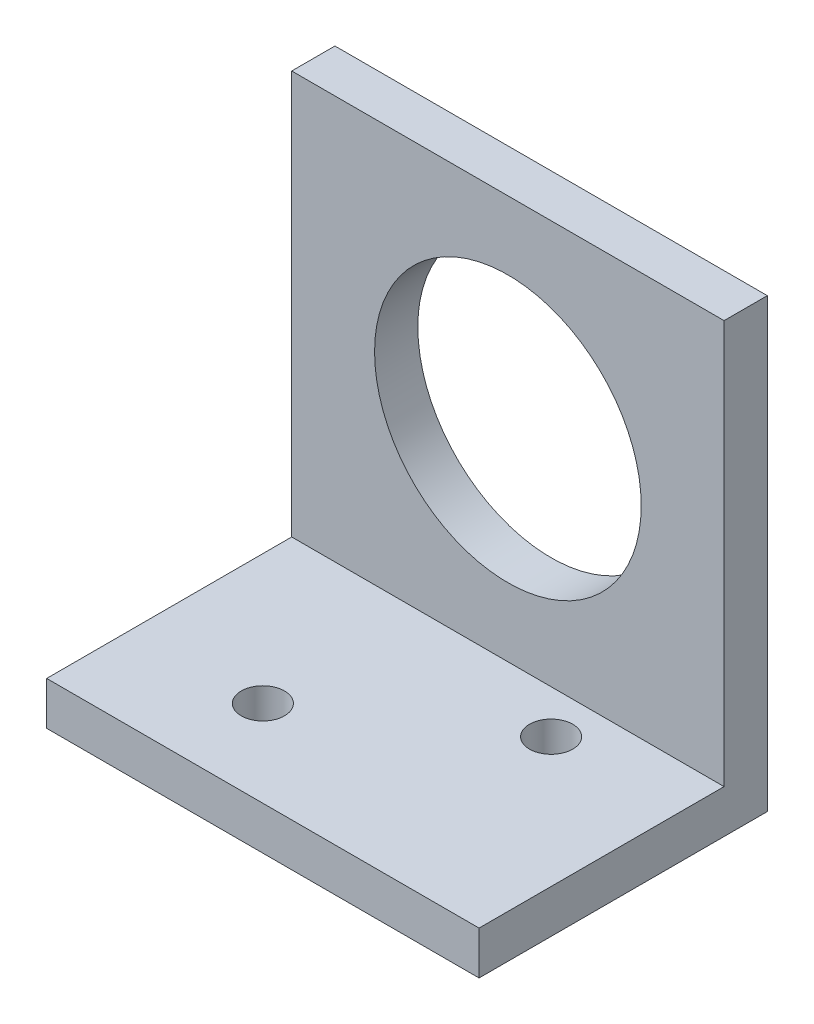
from build123d import *

# Parameters (mm, degrees)
SKETCH1_W           = 30
SKETCH1_H           = 20
SKETCH1_R           = 1.5
BOSS_EXTRUDE1_DEPTH = 3
SKETCH2_W           = 30
SKETCH2_H           = 3
BOSS_EXTRUDE2_DEPTH = 28
SKETCH3_R           = 9.25
CUT_EXTRUDE1_DEPTH  = 17


with BuildPart() as part:
    # Sketch1 → Boss-Extrude1 (new body)
    with BuildSketch(Plane(origin=(0, 0, 0), x_dir=(1, 0, 0), z_dir=(0, 1, 0))):
        Rectangle(SKETCH1_W, SKETCH1_H)
        with Locations(Location((-6, -4, 0), (0, 0, 270))):
            Circle(SKETCH1_R, mode=Mode.SUBTRACT)
        with Locations(Location((6, 4, 0), (0, 0, 270))):
            Circle(SKETCH1_R, mode=Mode.SUBTRACT)
    extrude(amount=BOSS_EXTRUDE1_DEPTH)

    # Sketch2 → Boss-Extrude2 (add)
    with BuildSketch(Plane(origin=(0, 3, 0), x_dir=(1, 0, 0), z_dir=(0, 1, 0))):
        with Locations((0, 8.5)):
            Rectangle(SKETCH2_W, SKETCH2_H)
    extrude(amount=BOSS_EXTRUDE2_DEPTH)

    # Sketch3 → Cut-Extrude1 (cut)
    with BuildSketch(Plane.XY.offset(-7)):
        with Locations((0, 17)):
            Circle(SKETCH3_R)
    extrude(amount=-CUT_EXTRUDE1_DEPTH, mode=Mode.SUBTRACT)


solid = part.part
